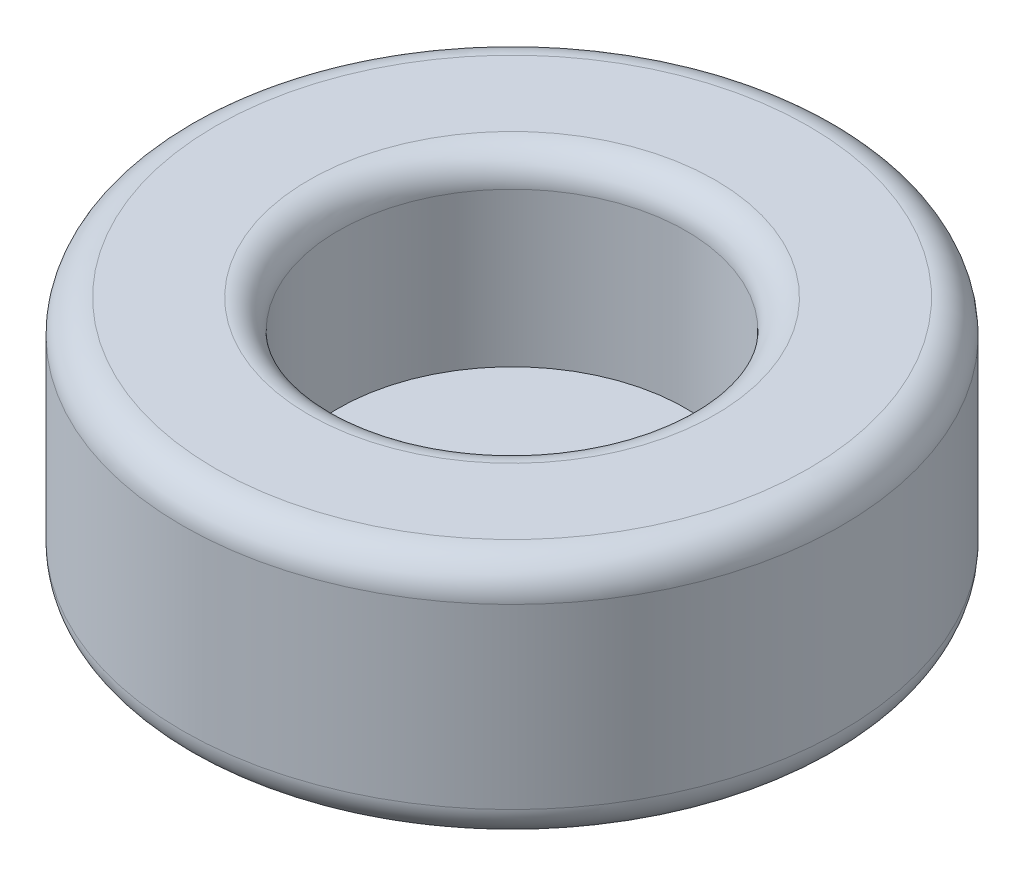
from build123d import *

# Parameters (mm, degrees)
SKETCH1_R           = 228.6
BOSS_EXTRUDE1_DEPTH = 168.91
FILLET1_R           = 22.86
SKETCH2_R           = 120.65
CUT_EXTRUDE1_DEPTH  = 127
FILLET2_R           = 20.32


with BuildPart() as part:
    # Sketch1 → Boss-Extrude1 (new body)
    with BuildSketch(Plane(origin=(0, 0, 0), x_dir=(1, 0, 0), z_dir=(0, 1, 0))):
        with Locations(Location((0, 0, 0), (0, 0, 270))):
            Circle(SKETCH1_R)
    extrude(amount=BOSS_EXTRUDE1_DEPTH)

    # Fillet1
    fillet1_edges = [part.edges().sort_by_distance(p)[0] for p in [
        (0, 0, -228.6),
        (0, 168.91, -228.6),
    ]]
    fillet(fillet1_edges, radius=FILLET1_R)

    # Sketch2 → Cut-Extrude1 (cut)
    with BuildSketch(Plane(origin=(0, 168.91, 0), x_dir=(1, 0, 0), z_dir=(0, 1, 0))):
        with Locations(Location((0, 0, 0), (0, 0, 270))):
            Circle(SKETCH2_R)
    extrude(amount=-CUT_EXTRUDE1_DEPTH, mode=Mode.SUBTRACT)

    # Fillet2
    fillet2_edges = [part.edges().sort_by_distance(p)[0] for p in [
        (0, 168.91, -120.65),
    ]]
    fillet(fillet2_edges, radius=FILLET2_R)


solid = part.part
